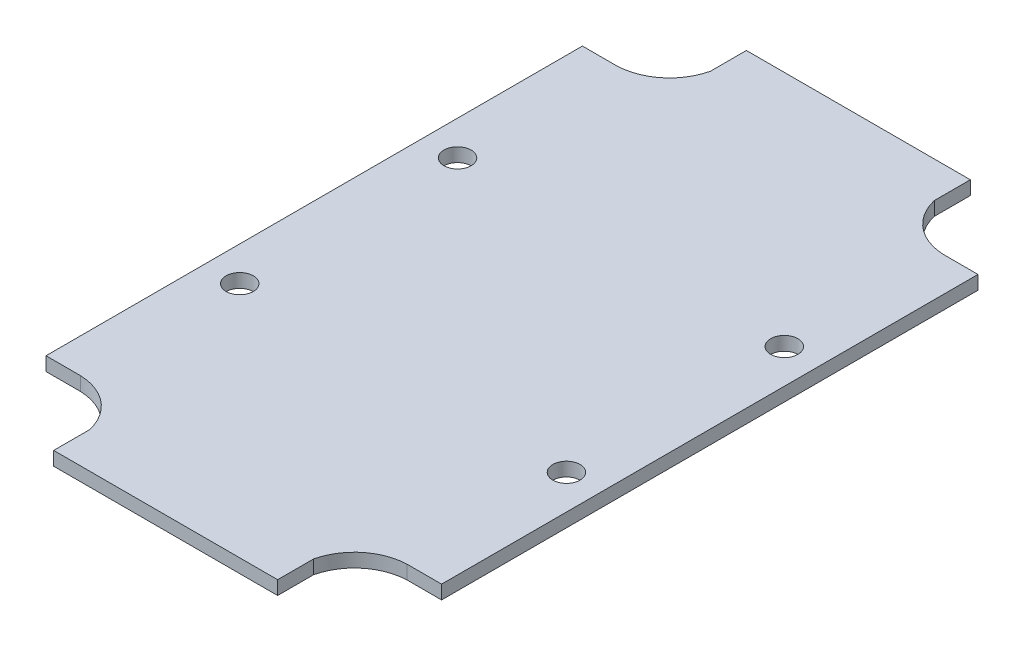
from build123d import *

# Parameters (mm, degrees)
BOSS_EXTRUDE1_DEPTH = 1.6
SKETCH2_R           = 1.5875
CUT_EXTRUDE1_DEPTH  = 47.534935159


with BuildPart() as part:
    # Sketch1 → Boss-Extrude1 (new body)
    with BuildSketch(Plane(origin=(0, 0, 0), x_dir=(1, 0, 0), z_dir=(0, 1, 0))):
        with BuildLine():
            Line((-23.0632, 31.273950746), (-19.05, 31.273950746))
            ThreePointArc((-19.05, 31.273950746), (-15.214318255, 32.713055735), (-13.055721082, 36.195))
            Line((-13.055721082, 36.195), (-13.055721082, 40.386))
            Line((-13.055721082, 40.386), (13.055721082, 40.386))
            Line((13.055721082, 40.386), (13.055721082, 36.195))
            ThreePointArc((13.055721082, 36.195), (15.214318255, 32.713055735), (19.05, 31.273950746))
            Line((19.05, 31.273950746), (23.0632, 31.273950746))
            Line((23.0632, 31.273950746), (23.0632, -31.273950746))
            Line((23.0632, -31.273950746), (19.05, -31.273950746))
            ThreePointArc((19.05, -31.273950746), (15.214318255, -32.713055735), (13.055721082, -36.195))
            Line((13.055721082, -36.195), (13.055721082, -40.386))
            Line((13.055721082, -40.386), (-13.055721082, -40.386))
            Line((-13.055721082, -40.386), (-13.055721082, -36.195))
            ThreePointArc((-13.055721082, -36.195), (-15.214318255, -32.713055735), (-19.05, -31.273950746))
            Line((-19.05, -31.273950746), (-23.0632, -31.273950746))
            Line((-23.0632, -31.273950746), (-23.0632, 0))
            Line((-23.0632, 0), (-23.0632, 31.273950746))
        make_face()
    extrude(amount=BOSS_EXTRUDE1_DEPTH)

    # Sketch2 → Cut-Extrude1 (cut, through all)
    with BuildSketch(Plane(origin=(0, 1.6, 0), x_dir=(1, 0, 0), z_dir=(0, 1, 0))):
        with Locations(Location((-19.05, 12.7, 0), (0, 0, 270))):
            Circle(SKETCH2_R)
        with Locations(Location((19.05, 12.7, 0), (0, 0, 90))):
            Circle(SKETCH2_R)
        with Locations(Location((19.05, -12.7, 0), (0, 0, 270))):
            Circle(SKETCH2_R)
        with Locations(Location((-19.05, -12.7, 0), (0, 0, 90))):
            Circle(SKETCH2_R)
    extrude(amount=-CUT_EXTRUDE1_DEPTH, mode=Mode.SUBTRACT)


solid = part.part
